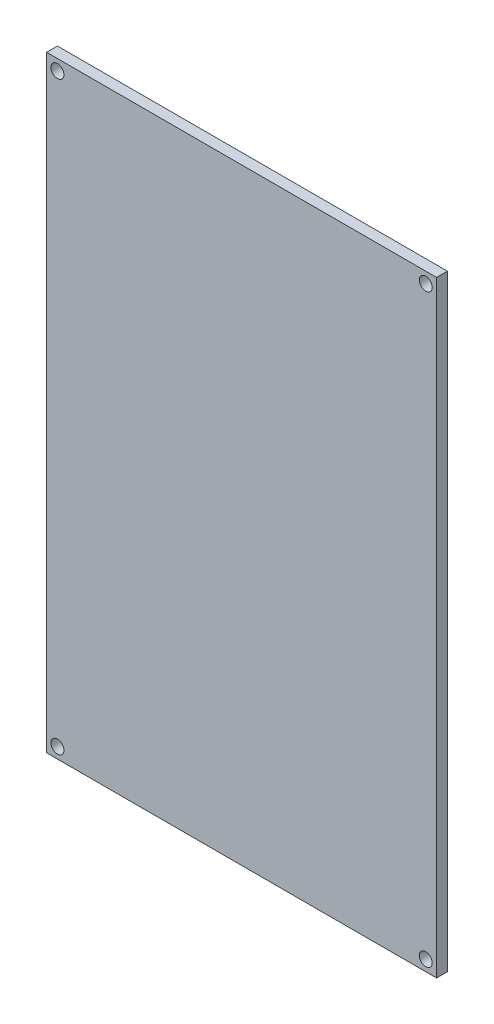
from build123d import *

# Parameters (mm, degrees)
SKETCH1_W           = 114.3
SKETCH1_H           = 177.8
BOSS_EXTRUDE1_DEPTH = 3.175
SKETCH2_R           = 1.905
CUT_EXTRUDE1_DEPTH  = 212.393970172


with BuildPart() as part:
    # Sketch1 → Boss-Extrude1 (new body)
    with BuildSketch(Plane.XY):
        with Locations((57.15, 88.9)):
            Rectangle(SKETCH1_W, SKETCH1_H)
    extrude(amount=BOSS_EXTRUDE1_DEPTH)

    # Sketch2 → Cut-Extrude1 (cut, through all)
    with BuildSketch(Plane.XY.offset(3.175)):
        with Locations((3.175, 174.625)):
            Circle(SKETCH2_R)
        with Locations((111.125, 174.625)):
            Circle(SKETCH2_R)
        with Locations((111.125, 3.175)):
            Circle(SKETCH2_R)
        with Locations((3.175, 3.175)):
            Circle(SKETCH2_R)
    extrude(amount=-CUT_EXTRUDE1_DEPTH, mode=Mode.SUBTRACT)


solid = part.part
